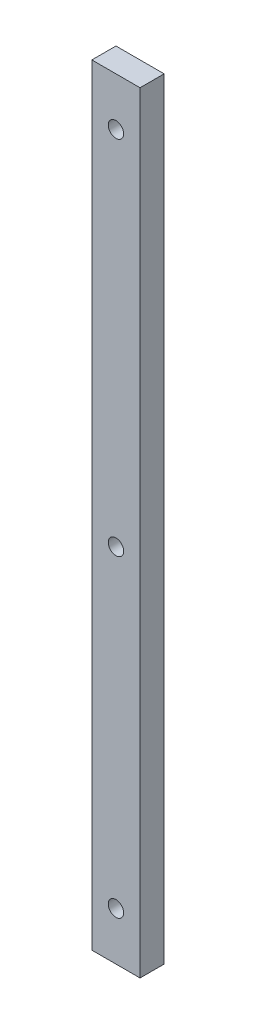
from build123d import *

# Parameters (mm, degrees)
ESQUISSE1_W        = 10
ESQUISSE1_H        = 160
ESQUISSE1_R        = 1.6
BOSS_EXTRU_1_DEPTH = 5


with BuildPart() as part:
    # Esquisse1 → Boss.-Extru.1 (new body)
    with BuildSketch(Plane.XY):
        with Locations((5, 80)):
            Rectangle(ESQUISSE1_W, ESQUISSE1_H)
        with Locations((5, 10)):
            Circle(ESQUISSE1_R, mode=Mode.SUBTRACT)
        with Locations(Location((5, 150, 0), (0, 0, 180))):
            Circle(ESQUISSE1_R, mode=Mode.SUBTRACT)
        with Locations((5, 75)):
            Circle(ESQUISSE1_R, mode=Mode.SUBTRACT)
    extrude(amount=BOSS_EXTRU_1_DEPTH)


solid = part.part
